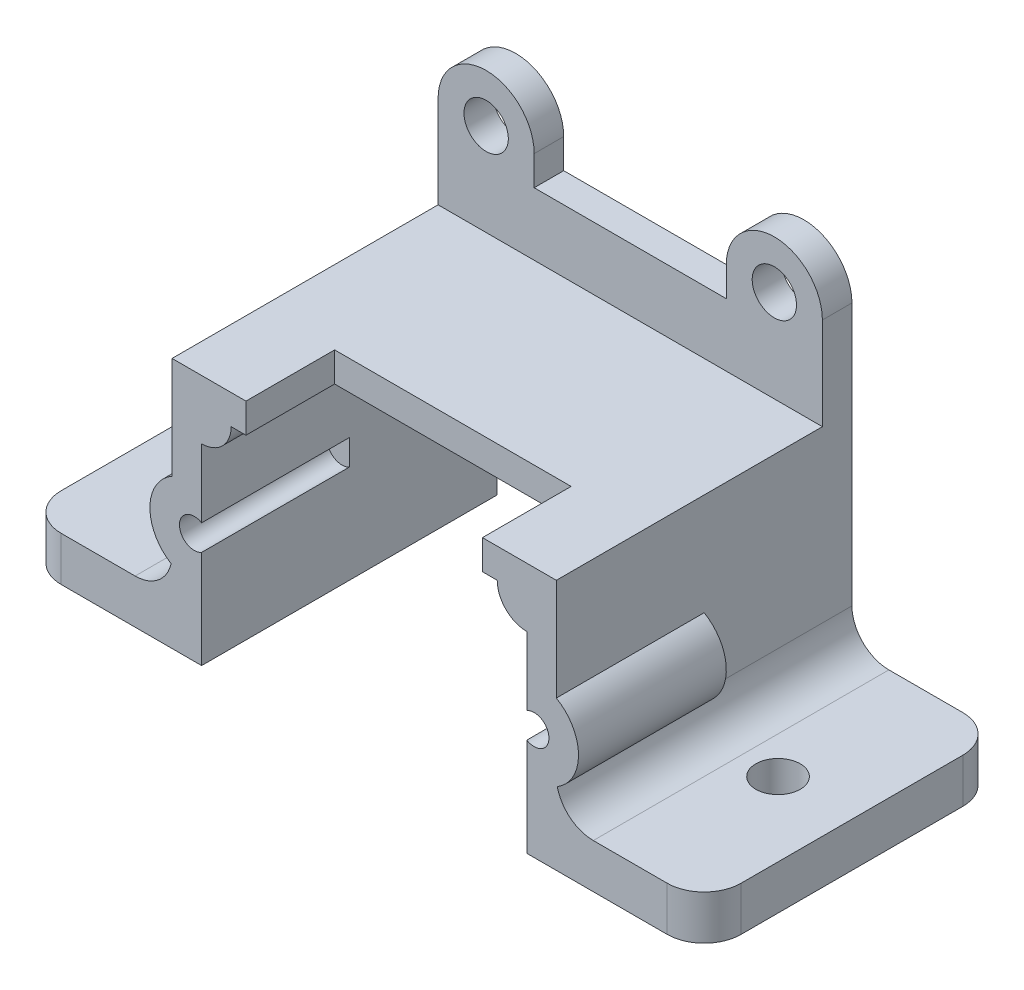
from build123d import *

# Parameters (mm, degrees)
EXTRUDE_1_DEPTH     = 20
CUT_EXTRUDE_1_DEPTH = 20
EXTRUDE_2_DEPTH     = 12.5
SKETCH_4_W          = 4.208324297
SKETCH_4_H          = 5.852484321
SKETCH_4_W_2        = 6.809838445
SKETCH_4_H_2        = 5.603711631
CUT_EXTRUDE_2_DEPTH = 10
EXTRUDE_3_DEPTH     = 10
SKETCH_6_W          = 10
SKETCH_6_H          = 20
EXTRUDE_4_DEPTH     = 3
SKETCH_7_R          = 1.5
CUT_EXTRUDE_3_DEPTH = 3
FILLET_1_R          = 2.5
SKETCH_8_R          = 1.5
EXTRUDE_5_DEPTH     = 2


with BuildPart() as part:
    # 草图1 → 凸台-拉伸1 (new body)
    with BuildSketch(Plane.XY):
        with BuildLine():
            Line((-15.073529412, 6.665686275), (10.926470588, 6.665686275))
            Line((10.926470588, 6.665686275), (10.926470588, -0.236237514))
            ThreePointArc((10.926470588, -0.236237514), (12.426470588, -2.834313725), (10.926470588, -5.432389937))
            Line((10.926470588, -5.432389937), (10.926470588, -10.334313725))
            Line((10.926470588, -10.334313725), (8.926470588, -10.334313725))
            Line((8.926470588, -10.334313725), (8.926470588, -3.700339129))
            ThreePointArc((8.926470588, -3.700339129), (10.426470588, -2.834313725), (8.926470588, -1.968288322))
            Line((8.926470588, -1.968288322), (8.926470588, 4.665686275))
            Line((8.926470588, 4.665686275), (-13.073529412, 4.665686275))
            Line((-13.073529412, 4.665686275), (-13.073529412, -1.968288322))
            ThreePointArc((-13.073529412, -1.968288322), (-14.573529412, -2.834313725), (-13.073529412, -3.700339129))
            Line((-13.073529412, -3.700339129), (-13.073529412, -10.334313725))
            Line((-13.073529412, -10.334313725), (-15.073529412, -10.334313725))
            Line((-15.073529412, -10.334313725), (-15.073529412, -5.432389937))
            ThreePointArc((-15.073529412, -5.432389937), (-16.573529412, -2.834313725), (-15.073529412, -0.236237514))
            Line((-15.073529412, -0.236237514), (-15.073529412, 6.665686275))
        make_face()
    extrude(amount=EXTRUDE_1_DEPTH)

    # 草图2 → 切除-拉伸1 (cut)
    with BuildSketch(Plane(origin=(0, 6.665686275, 0), x_dir=(1, 0, 0), z_dir=(0, 1, 0))):
        Polygon((-2.073529412, -14), (-10.073529412, -14), (-10.073529412, -20), (5.926470588, -20), (5.926470588, -14), align=None)
    extrude(amount=-CUT_EXTRUDE_1_DEPTH, mode=Mode.SUBTRACT)

    # 草图3 → 凸台-拉伸2 (add)
    with BuildSketch(Plane.XY.offset(20)):
        with BuildLine():
            Line((-13.073529412, 4.665686275), (-13.073529412, 2.665686275))
            ThreePointArc((-13.073529412, 2.665686275), (-11.659315849, 3.251472712), (-11.073529412, 4.665686275))
            Line((-11.073529412, 4.665686275), (-13.073529412, 4.665686275))
        make_face()
        with BuildLine():
            Line((8.926470588, 4.665686275), (8.926470588, 2.665686275))
            ThreePointArc((8.926470588, 2.665686275), (7.512257026, 3.251472712), (6.926470588, 4.665686275))
            Line((6.926470588, 4.665686275), (8.926470588, 4.665686275))
        make_face()
    extrude(amount=-EXTRUDE_2_DEPTH)

    # 草图4 → 切除-拉伸2 (cut)
    with BuildSketch(Plane(origin=(0, 0, 0), x_dir=(-1, 0, 0), z_dir=(0, 0, -1))):
        with Locations((-13.030632737, -3.162479675)):
            Rectangle(SKETCH_4_W, SKETCH_4_H)
        with Locations((18.478448635, -3.03809333)):
            Rectangle(SKETCH_4_W_2, SKETCH_4_H_2)
    extrude(amount=-CUT_EXTRUDE_2_DEPTH, mode=Mode.SUBTRACT)

    # 草图5 → 凸台-拉伸3 (add)
    with BuildSketch(Plane(origin=(0, 0, 0), x_dir=(-1, 0, 0), z_dir=(0, 0, -1))):
        with BuildLine():
            Line((-8.926470588, -1.968288322), (-8.926470588, -3.700339129))
            ThreePointArc((-8.926470588, -3.700339129), (-10.426470588, -2.834313725), (-8.926470588, -1.968288322))
        make_face()
        with BuildLine():
            Line((13.073529412, -1.968288322), (13.073529412, -3.700339129))
            ThreePointArc((13.073529412, -3.700339129), (14.573529412, -2.834313725), (13.073529412, -1.968288322))
        make_face()
    extrude(amount=-EXTRUDE_3_DEPTH)

    # 草图6 → 凸台-拉伸4 (add)
    with BuildSketch(Plane.XZ.offset(10.334313725)):
        with Locations((15.926470588, 10)):
            Rectangle(SKETCH_6_W, SKETCH_6_H)
        with Locations((-20.073529412, 10)):
            Rectangle(SKETCH_6_W, SKETCH_6_H)
    extrude(amount=-EXTRUDE_4_DEPTH)

    # 草图7 → 切除-拉伸3 (cut)
    with BuildSketch(Plane(origin=(0, -7.334313725, 0), x_dir=(1, 0, 0), z_dir=(0, 1, 0))):
        with Locations(Location((15.926470588, -10, 0), (0, 0, 270))):
            Circle(SKETCH_7_R)
        with Locations(Location((-20.073529412, -10, 0), (0, 0, 270))):
            Circle(SKETCH_7_R)
    extrude(amount=-CUT_EXTRUDE_3_DEPTH, mode=Mode.SUBTRACT)

    # 圆角1
    fillet_1_edges = [part.edges().sort_by_distance(p)[0] for p in [
        (-15.073529412, -7.334313725, 10),
        (10.926470588, -7.334313725, 10),
        (20.926470588, -8.834313725, 20),
        (-25.073529412, -8.834313725, 20),
        (20.926470588, -8.834313725, 0),
        (-25.073529412, -8.834313725, 0),
    ]]
    fillet(fillet_1_edges, radius=FILLET_1_R)

    # 草图8 → 凸台-拉伸5 (add)
    with BuildSketch(Plane(origin=(0, 0, 0), x_dir=(-1, 0, 0), z_dir=(0, 0, -1))):
        with BuildLine():
            Line((-4.426470588, 10.915686275), (8.573529412, 10.915686275))
            Line((8.573529412, 10.915686275), (8.573529412, 12.915686275))
            ThreePointArc((8.573529412, 12.915686275), (11.823529412, 16.165686275), (15.073529412, 12.915686275))
            Line((15.073529412, 12.915686275), (15.073529412, 6.665686275))
            Line((15.073529412, 6.665686275), (8.573529412, 6.665686275))
            Line((8.573529412, 6.665686275), (-4.426470588, 6.665686275))
            Line((-4.426470588, 6.665686275), (-10.926470588, 6.665686275))
            Line((-10.926470588, 6.665686275), (-10.926470588, 12.915686275))
            ThreePointArc((-10.926470588, 12.915686275), (-7.676470588, 16.165686275), (-4.426470588, 12.915686275))
            Line((-4.426470588, 12.915686275), (-4.426470588, 10.915686275))
        make_face()
        with Locations((-7.676470588, 12.915686275)):
            Circle(SKETCH_8_R, mode=Mode.SUBTRACT)
        with Locations((11.823529412, 12.915686275)):
            Circle(SKETCH_8_R, mode=Mode.SUBTRACT)
    extrude(amount=-EXTRUDE_5_DEPTH)


solid = part.part
